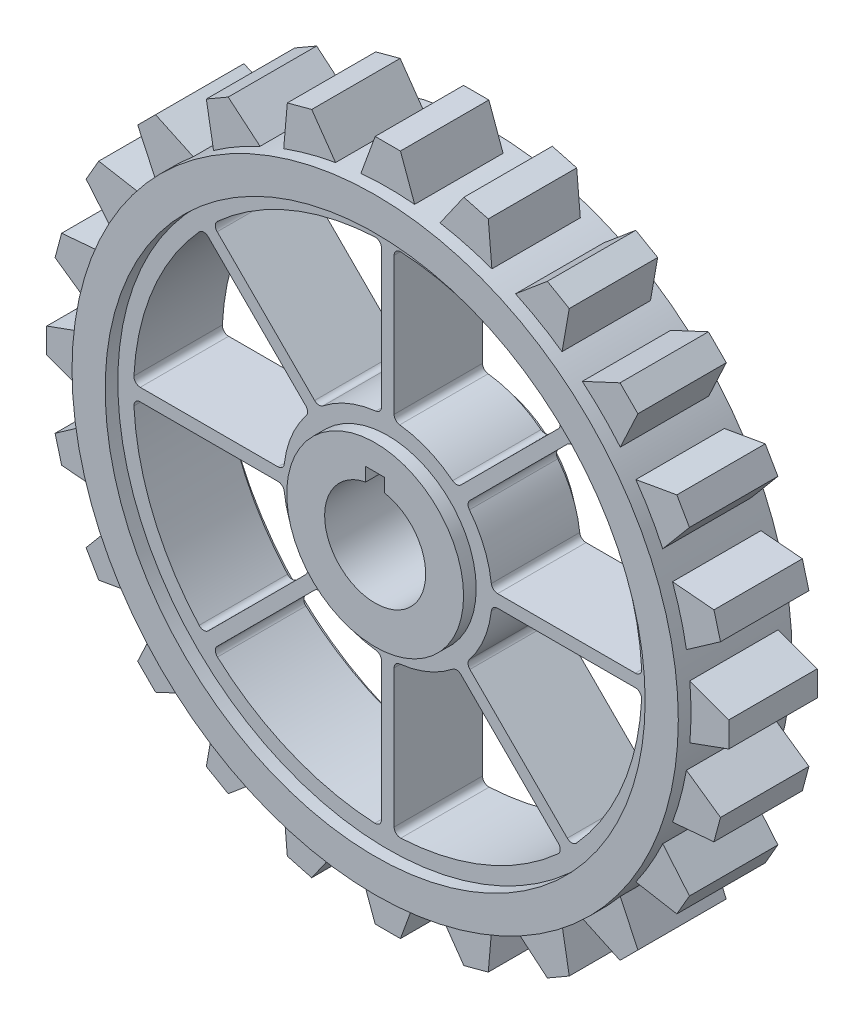
from build123d import *

# Parameters (mm, degrees)
BOSS_EXTRUDE5_START = -2
BOSS_EXTRUDE5_DEPTH = 14
BOSS_EXTRUDE6_DEPTH = 18
CIRPATTERN2_COUNT   = 24
SKETCH2_R           = 42.75
SKETCH2_R_2         = 14
CUT_EXTRUDE3_DEPTH  = 2
CUT_EXTRUDE5_REACH  = 80.46
CIRPATTERN3_COUNT   = 8
CUT_EXTRUDE7_REACH  = 80.46


with BuildPart() as part:
    # Sketch1 → Boss-Extrude5 (new body)
    with BuildSketch(Plane.XY.offset(BOSS_EXTRUDE5_START)):
        with BuildLine():
            Line((-2, 54.00000000000005), (2, 54.00000000000005))
            Line((2, 54.00000000000005), (4.252519054963002, 47.81125475959794))
            ThreePointArc((4.252519054963002, 47.81125475959794), (-6.18e-15, 47.9999999999999), (-4.252519054963002, 47.81125475959794))
            Line((-4.252519054963002, 47.81125475959794), (-2, 54.00000000000005))
        make_face()
    boss_extrude5 = extrude(amount=-BOSS_EXTRUDE5_DEPTH)

    # Sketch1<8> → Boss-Extrude6 (add)
    with BuildSketch(Plane.XY):
        with BuildLine():
            ThreePointArc((4.2525190549630025, 47.81125475959794), (2.94e-15, 48), (-4.252519054963008, 47.81125475959794))
            ThreePointArc((-4.252519054963008, 47.81125475959794), (-32.40277060192367, -35.41271603985087), (48, -1.176e-14))
            ThreePointArc((48, 0), (35.412716039850885, 32.40277060192365), (4.252519054963013, 47.81125475959794))
        make_face()
    extrude(amount=-BOSS_EXTRUDE6_DEPTH)

    # CirPattern2: Boss-Extrude5 ×24 about axis
    cirpattern2_axis = Axis((0, 0, 0), (0, 0, 1))
    for i in range(1, CIRPATTERN2_COUNT):
        add(boss_extrude5.rotate(cirpattern2_axis, i * 360 / CIRPATTERN2_COUNT))

    # Sketch2 → Cut-Extrude3 (cut)
    with BuildSketch(Plane.XY):
        Circle(SKETCH2_R)
        with BuildLine():
            Line((-1.0000000000001241, -17.385338650713706), (-1.000000000000274, -39.199011467127576))
            ThreePointArc((-1.0000000000002747, -39.199011467127576), (-1.3111442146622836, -39.92390987863526), (-2.05095541401302, -40.19771239622636))
            ThreePointArc((-2.0509554140130195, -40.197712396226365), (-15.40300815269503, -37.18615118357923), (-26.973830542398602, -29.874319504717846))
            ThreePointArc((-26.973830542398602, -29.874319504717846), (-27.30334844136264, -29.157586371964566), (-27.010780043028657, -28.42499360540166))
            Line((-27.010780043028657, -28.42499360540166), (-11.586184071957724, -13.000397634330783))
            ThreePointArc((-11.586184071957724, -13.000397634330783), (-10.936313979625764, -12.709143778548423), (-10.25741573129854, -12.924218448916342))
            ThreePointArc((-10.25741573129854, -12.924218448916342), (-6.314276634024052, -15.244012286436213), (-1.885714285714402, -16.39189072781577))
            ThreePointArc((-1.8857142857144022, -16.39189072781577), (-1.2535799727079378, -16.71986352506501), (-1.0000000000001235, -17.385338650713706))
        make_face(mode=Mode.SUBTRACT)
        with BuildLine():
            Line((-13.000397634330895, -11.586184071957586), (-28.424993605401934, -27.010780043028358))
            ThreePointArc((-28.424993605401934, -27.010780043028358), (-29.157586371964843, -27.303348441362328), (-29.874319504718116, -26.97383054239828))
            ThreePointArc((-29.874319504718123, -26.973830542398282), (-37.1861511835794, -15.403008152694639), (-40.19771239622639, -2.050955414012602))
            ThreePointArc((-40.19771239622639, -2.0509554140126016), (-39.923909878635286, -1.3111442146618666), (-39.1990114671276, -0.9999999999998632))
            Line((-39.1990114671276, -0.9999999999998669), (-17.38533865071372, -0.9999999999999454))
            ThreePointArc((-17.38533865071372, -0.9999999999999459), (-16.719863525065026, -1.253579972707767), (-16.3918907278158, -1.885714285714234))
            ThreePointArc((-16.3918907278158, -1.8857142857142335), (-15.244012286436279, -6.314276634023894), (-12.924218448916434, -10.2574157312984))
            ThreePointArc((-12.924218448916436, -10.2574157312984), (-12.709143778548526, -10.936313979625629), (-13.000397634330895, -11.586184071957586))
        make_face(mode=Mode.SUBTRACT)
        with BuildLine():
            Line((11.586184071957627, -13.000397634330856), (27.01078004302845, -28.42499360540184))
            ThreePointArc((27.01078004302845, -28.42499360540184), (27.303348441362424, -29.157586371964747), (26.97383054239838, -29.87431950471802))
            ThreePointArc((26.973830542398378, -29.874319504718027), (15.403008152694767, -37.18615118357935), (2.050955414012739, -40.197712396226386))
            ThreePointArc((2.050955414012739, -40.197712396226386), (1.311144214662002, -39.92390987863528), (1.000000000000001, -39.19901146712759))
            Line((1.0000000000000004, -39.19901146712759), (1.0000000000000027, -17.38533865071372))
            ThreePointArc((1.000000000000003, -17.38533865071372), (1.253579972707823, -16.719863525065026), (1.8857142857142877, -16.391890727815795))
            ThreePointArc((1.8857142857142881, -16.3918907278158), (6.314276634023944, -15.24401228643626), (10.257415731298444, -12.924218448916402))
            ThreePointArc((10.25741573129844, -12.924218448916404), (10.936313979625668, -12.709143778548489), (11.586184071957627, -13.000397634330856))
        make_face(mode=Mode.SUBTRACT)
        with BuildLine():
            Line((17.38533865071371, -1.0000000000000633), (39.199011467127576, -1.0000000000001372))
            ThreePointArc((39.199011467127576, -1.0000000000001399), (39.923909878635264, -1.311144214662142), (40.197712396226365, -2.0509554140128796))
            ThreePointArc((40.19771239622636, -2.0509554140128854), (37.186151183579284, -15.403008152694898), (29.874319504717935, -26.9738305423985))
            ThreePointArc((29.874319504717935, -26.9738305423985), (29.157586371964655, -27.30334844136254), (28.42499360540175, -27.010780043028557))
            Line((28.42499360540175, -27.010780043028557), (13.000397634330819, -11.586184071957678))
            ThreePointArc((13.000397634330819, -11.586184071957678), (12.709143778548459, -10.93631397962572), (12.924218448916376, -10.257415731298497))
            ThreePointArc((12.924218448916378, -10.257415731298497), (15.244012286436238, -6.314276634024001), (16.391890727815774, -1.8857142857143443))
            ThreePointArc((16.391890727815774, -1.885714285714345), (16.719863525065012, -1.253579972707878), (17.38533865071371, -1.0000000000000626))
        make_face(mode=Mode.SUBTRACT)
        with BuildLine():
            Line((-17.3853386507137, 1.0000000000001812), (-39.19901146712757, 1.0000000000004077))
            ThreePointArc((-39.19901146712757, 1.0000000000004041), (-39.92390987863525, 1.3111442146624157), (-40.19771239622635, 2.0509554140131567))
            ThreePointArc((-40.19771239622635, 2.0509554140131643), (-37.186151183579184, 15.403008152695161), (-29.874319504717757, 26.973830542398705))
            ThreePointArc((-29.874319504717754, 26.973830542398705), (-29.15758637196447, 27.303348441362743), (-28.424993605401564, 27.010780043028756))
            Line((-28.424993605401564, 27.010780043028756), (-13.000397634330742, 11.58618407195777))
            ThreePointArc((-13.000397634330742, 11.58618407195777), (-12.709143778548388, 10.93631397962581), (-12.924218448916308, 10.257415731298588))
            ThreePointArc((-12.924218448916305, 10.257415731298586), (-15.244012286436194, 6.314276634024106), (-16.391890727815756, 1.885714285714457))
            ThreePointArc((-16.39189072781576, 1.8857142857144558), (-16.719863525065, 1.2535799727079926), (-17.3853386507137, 1.0000000000001825))
        make_face(mode=Mode.SUBTRACT)
        with BuildLine():
            ThreePointArc((-2.0509554140130195, 40.19771239622637), (-1.3111442146622792, 39.92390987863527), (-1.0000000000002722, 39.19901146712758))
            Line((-1.000000000000274, 39.19901146712758), (-1.0000000000001241, 17.385338650713713))
            ThreePointArc((-1.0000000000001248, 17.385338650713713), (-1.0144802004675173, 17.21577826403919), (-1.0575014494585484, 17.051128414145417))
            ThreePointArc((-1.0575014494585484, 17.051128414145417), (-1.3772265039632767, 16.602936469841204), (-1.8857142857144022, 16.39189072781578))
            ThreePointArc((-1.8857142857144022, 16.39189072781578), (-6.314276634023946, 15.244012286436256), (-10.257415731298357, 12.924218448916477))
            ThreePointArc((-10.257415731298355, 12.924218448916475), (-10.936313979625584, 12.709143778548567), (-11.58618407195754, 13.00039763433094))
            Line((-11.58618407195754, 13.00039763433094), (-27.01078004302826, 28.424993605402026))
            ThreePointArc((-27.01078004302826, 28.424993605402026), (-27.30334844136223, 29.157586371964936), (-26.97383054239818, 29.874319504718212))
            ThreePointArc((-26.97383054239818, 29.87431950471822), (-15.40300815269477, 37.18615118357935), (-2.0509554140130195, 40.19771239622637))
        make_face(mode=Mode.SUBTRACT)
        Circle(SKETCH2_R_2, mode=Mode.SUBTRACT)
        with BuildLine():
            Line((13.000397634330822, 11.586184071957678), (28.42499360540175, 27.010780043028557))
            ThreePointArc((28.42499360540175, 27.010780043028557), (29.157586371964655, 27.30334844136253), (29.87431950471793, 26.973830542398492))
            ThreePointArc((29.87431950471793, 26.973830542398485), (37.186151183579284, 15.403008152694891), (40.19771239622638, 2.0509554140128787))
            ThreePointArc((40.19771239622638, 2.0509554140128787), (39.92390987863528, 1.311144214662141), (39.19901146712759, 1.0000000000001388))
            Line((39.19901146712759, 1.0000000000001372), (17.385338650713717, 1.0000000000000633))
            ThreePointArc((17.385338650713717, 1.0000000000000622), (16.719863525065023, 1.2535799727078802), (16.391890727815788, 1.8857142857143452))
            ThreePointArc((16.391890727815788, 1.885714285714345), (15.244012286436234, 6.314276634024), (12.924218448916367, 10.257415731298497))
            ThreePointArc((12.92421844891637, 10.257415731298494), (12.709143778548455, 10.93631397962572), (13.00039763433082, 11.586184071957678))
        make_face(mode=Mode.SUBTRACT)
        with BuildLine():
            Line((1.0000000000000027, 17.385338650713713), (1.0000000000000004, 39.19901146712758))
            ThreePointArc((0.9999999999999976, 39.19901146712758), (1.3111442146620025, 39.92390987863527), (2.0509554140127393, 40.19771239622637))
            ThreePointArc((2.0509554140127353, 40.19771239622638), (15.403008152694778, 37.186151183579355), (26.973830542398403, 29.87431950471804))
            ThreePointArc((26.9738305423984, 29.87431950471804), (27.30334844136244, 29.15758637196476), (27.010780043028465, 28.42499360540185))
            Line((27.010780043028465, 28.42499360540185), (11.586184071957636, 13.000397634330866))
            ThreePointArc((11.586184071957637, 13.000397634330866), (10.93631397962568, 12.709143778548501), (10.257415731298455, 12.924218448916417))
            ThreePointArc((10.257415731298455, 12.924218448916417), (6.314276634023947, 15.244012286436263), (1.8857142857142852, 16.39189072781578))
            ThreePointArc((1.8857142857142877, 16.39189072781578), (1.2535799727078194, 16.719863525065016), (1.0000000000000029, 17.385338650713713))
        make_face(mode=Mode.SUBTRACT)
    cut_extrude3 = extrude(amount=-CUT_EXTRUDE3_DEPTH, mode=Mode.SUBTRACT)

    # Mirror2: Cut-Extrude3 across plane
    add(cut_extrude3.mirror(Plane.XY.offset(-9)), mode=Mode.SUBTRACT)

    # Sketch3 → Cut-Extrude5 (cut, up to next)
    with BuildSketch(Plane.XY, mode=Mode.PRIVATE) as cut_extrude5_sk1:
        with BuildLine():
            Line((-27.01078004302825, 28.424993605402033), (-11.58618407195754, 13.00039763433094))
            ThreePointArc((-11.58618407195754, 13.00039763433094), (-10.936313979625584, 12.709143778548569), (-10.257415731298355, 12.924218448916479))
            ThreePointArc((-10.257415731298355, 12.924218448916479), (-6.31427663402394, 15.244012286436249), (-1.8857142857144011, 16.39189072781577))
            ThreePointArc((-1.8857142857144011, 16.39189072781577), (-1.253579972707947, 16.719863525065026), (-1.0000000000001183, 17.385338650713713))
            Line((-1.0000000000001183, 17.385338650713713), (-1.0000000000002787, 39.19901146712758))
            ThreePointArc((-1.0000000000002787, 39.19901146712758), (-1.3111442146622831, 39.923909878635264), (-2.050955414013019, 40.197712396226365))
            ThreePointArc((-2.050955414013019, 40.197712396226365), (-15.403008152694762, 37.186151183579334), (-26.97383054239818, 29.87431950471822))
            ThreePointArc((-26.97383054239818, 29.87431950471822), (-27.303348441362214, 29.15758637196494), (-27.01078004302825, 28.424993605402033))
        make_face()
    cut_extrude5_tool1 = extrude(cut_extrude5_sk1.sketch, amount=-CUT_EXTRUDE5_REACH, mode=Mode.PRIVATE) & part.part
    cut_extrude5 = cut_extrude5_tool1.solids().sort_by_distance((-11.308376, 27.300835, 0))[0]
    add(cut_extrude5, mode=Mode.SUBTRACT)

    # CirPattern3: Cut-Extrude5 ×8 about axis
    cirpattern3_axis = Axis((0, 0, -2), (0, 0, 1))
    for i in range(1, CIRPATTERN3_COUNT):
        add(cut_extrude5.rotate(cirpattern3_axis, i * 360 / CIRPATTERN3_COUNT), mode=Mode.SUBTRACT)

    # Sketch4 → Cut-Extrude7 (cut, up to next)
    with BuildSketch(Plane.XY, mode=Mode.PRIVATE) as cut_extrude7_sk1:
        with BuildLine():
            Line((-1.5, 10.000000000000009), (1.5, 10.000000000000009))
            Line((1.5, 10.000000000000009), (1.4999999999999993, 7.858116822750856))
            ThreePointArc((1.4999999999999993, 7.858116822750856), (-1.47e-15, -8), (-1.4999999999999993, 7.858116822750856))
            Line((-1.4999999999999993, 7.858116822750856), (-1.5, 10.000000000000009))
        make_face()
    cut_extrude7_tool1 = extrude(cut_extrude7_sk1.sketch, amount=-CUT_EXTRUDE7_REACH, mode=Mode.PRIVATE) & part.part
    add(cut_extrude7_tool1.solids().sort_by_distance((0, 0.266043, 0))[0], mode=Mode.SUBTRACT)


solid = part.part
